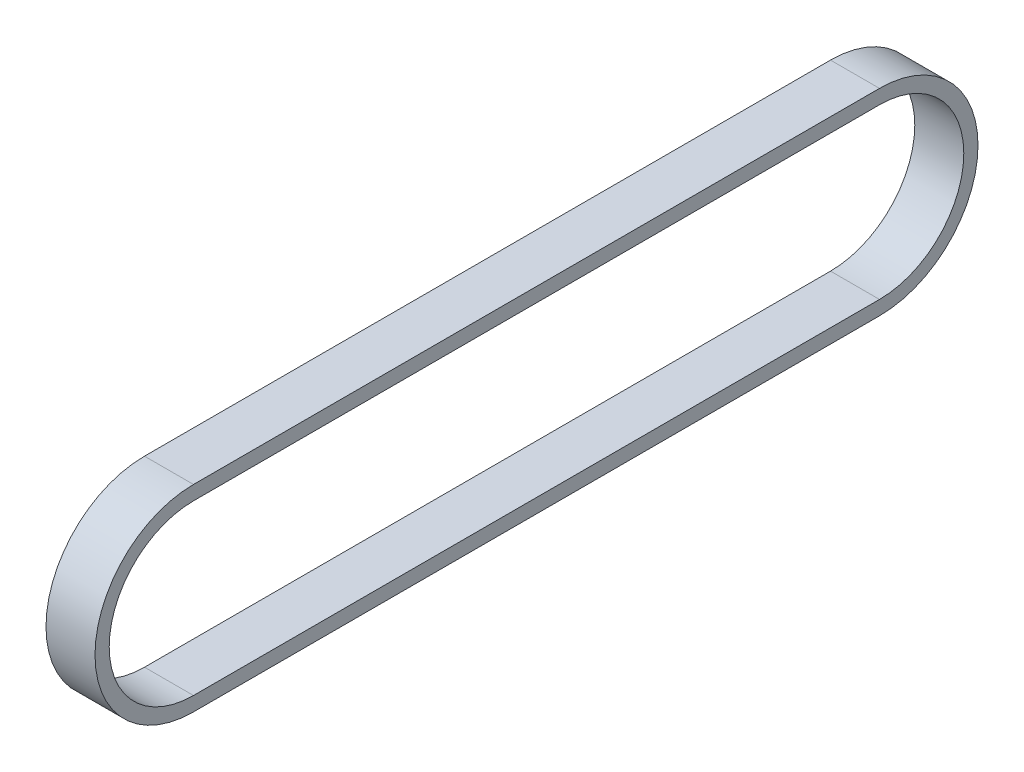
from build123d import *

# Parameters (mm, degrees)
BOSS_EXTRUDE1_DEPTH = 12.7


with BuildPart() as part:
    # Sketch1 → Boss-Extrude1 (new body)
    with BuildSketch(Plane(origin=(0, 0, 0), x_dir=(0, 0, -1), z_dir=(1, 0, 0))):
        with BuildLine():
            Line((0, 25.527), (177.8, 25.527))
            ThreePointArc((177.8, 25.527), (203.327, 0), (177.8, -25.527))
            Line((177.8, -25.527), (0, -25.527))
            ThreePointArc((0, -25.527), (-25.527, 0), (0, 25.527))
        make_face()
        with BuildLine():
            Line((0, 21.844), (177.8, 21.844))
            ThreePointArc((177.8, 21.844), (199.644, 0), (177.8, -21.844))
            Line((177.8, -21.844), (0, -21.844))
            ThreePointArc((0, -21.844), (-21.844, 0), (0, 21.844))
        make_face(mode=Mode.SUBTRACT)
    extrude(amount=BOSS_EXTRUDE1_DEPTH)


solid = part.part
